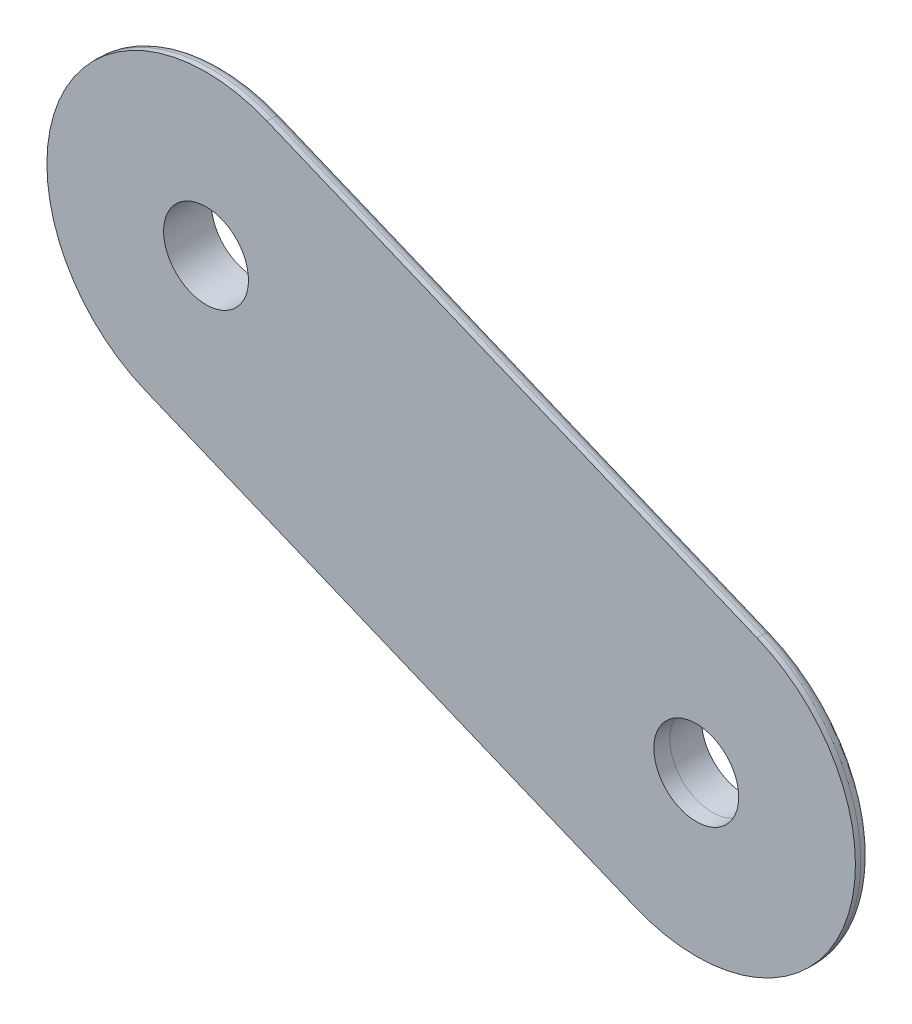
from build123d import *

# Parameters (mm, degrees)
SKETCH1_R             = 7.5
SKETCH1_R_2           = 4
BOSS_EXTRUDE1_DEPTH   = 3
BOSS_EXTRUDE1_2_DEPTH = 3
SKETCH2_R             = 4
BOSS_EXTRUDE2_DEPTH   = 1.5
FILLET1_R             = 1


with BuildPart() as part:
    # Sketch1 → Boss-Extrude1 (new body)
    with BuildSketch(Plane.XY):
        Circle(SKETCH1_R)
        Circle(SKETCH1_R_2, mode=Mode.SUBTRACT)
    extrude(amount=BOSS_EXTRUDE1_DEPTH)

    # Sketch2 → Boss-Extrude2 (add)
    with BuildSketch(Plane.XY.offset(3)):
        with BuildLine():
            Line((5.72773978, 13.863368891), (51.938969417, -5.229097043))
            ThreePointArc((51.938969417, -5.229097043), (60.074598528, -24.820205715), (40.483489857, -32.955834825))
            Line((40.483489857, -32.955834825), (-5.72773978, -13.863368891))
            ThreePointArc((-5.72773978, -13.863368891), (-13.863368891, 5.72773978), (5.72773978, 13.863368891))
        make_face()
        Circle(SKETCH2_R, mode=Mode.SUBTRACT)
        with Locations(Location((46.211229637, -19.092465934, 0), (0, 0, 180))):
            Circle(SKETCH2_R, mode=Mode.SUBTRACT)
    extrude(amount=BOSS_EXTRUDE2_DEPTH)

    # Fillet1
    fillet1_edges = [part.edges().sort_by_distance(p)[0] for p in [
        (-13.863368891, 5.72773978, 3),
        (17.377875038, -23.409601858, 3),
        (60.074598528, -24.820205715, 3),
        (28.833354599, 4.317135924, 3),
    ]]
    fillet(fillet1_edges, radius=FILLET1_R)


with BuildPart() as body_2:
    # Sketch1 → Boss-Extrude1 2 (new body)
    with BuildSketch(Plane.XY):
        with Locations(Location((46.211229637, -19.092465934, 0), (0, 0, 180))):
            Circle(SKETCH1_R)
        with Locations(Location((46.211229637, -19.092465934, 0), (0, 0, 180))):
            Circle(SKETCH1_R_2, mode=Mode.SUBTRACT)
    extrude(amount=BOSS_EXTRUDE1_2_DEPTH)


solid = Compound([part.part, body_2.part])
